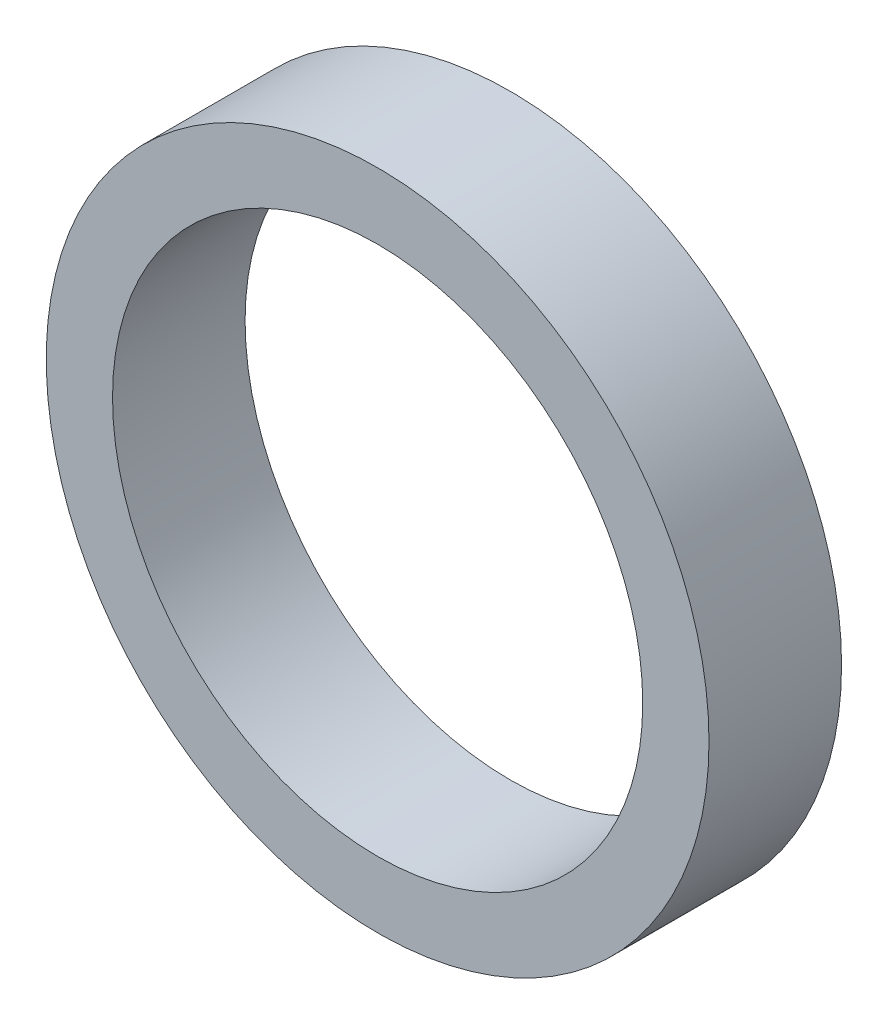
from build123d import *

# Parameters (mm, degrees)
SKETCH1_R           = 31.75
SKETCH1_R_2         = 25.4
BOSS_EXTRUDE1_DEPTH = 12.7


with BuildPart() as part:
    # Sketch1 → Boss-Extrude1 (new body)
    with BuildSketch(Plane.XY):
        Circle(SKETCH1_R)
        Circle(SKETCH1_R_2, mode=Mode.SUBTRACT)
    extrude(amount=BOSS_EXTRUDE1_DEPTH)


solid = part.part
